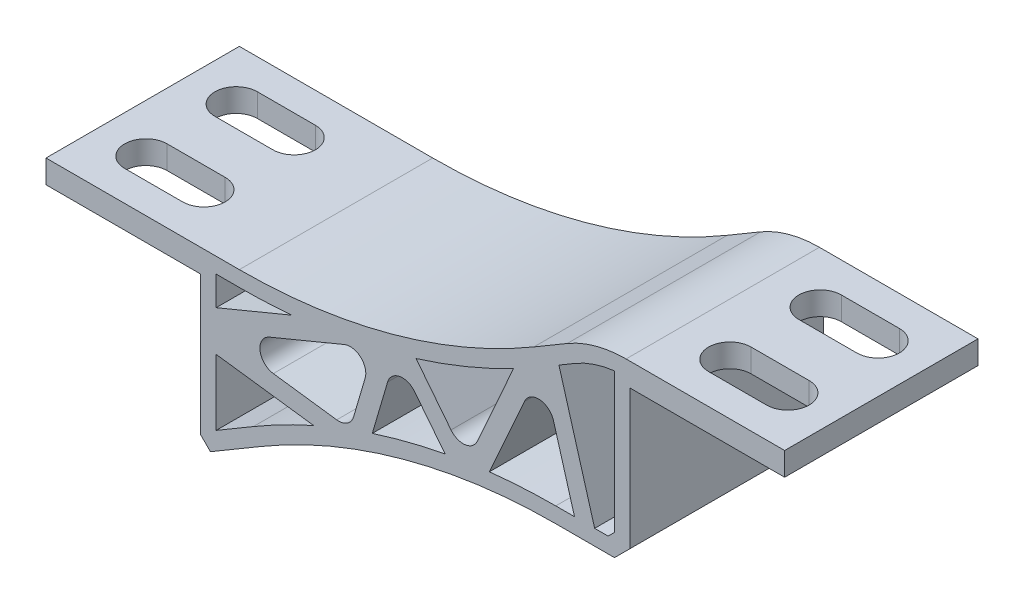
from build123d import *

# Parameters (mm, degrees)
BOSS_EXTRUDE1_DEPTH     = 25
CUT_EXTRUDE2_DEPTH      = 102.361975119
CUT_EXTRUDE2_DEPTH_BACK = 102.361975119
FILLET2_R               = 75
FILLET3_R               = 15
CHAMFER2_SIZE           = 2
CHAMFER3_SIZE           = 2
CHAMFER3_SIZE2          = 1.460674157
CUT_EXTRUDE3_DEPTH      = 101.57900879
CUT_EXTRUDE3_DEPTH_BACK = 101.57900879
FILLET4_R               = 2


with BuildPart() as part:
    # Sketch1 → Boss-Extrude1 (new body)
    with BuildSketch(Plane.XY):
        Polygon((0, 0), (0, 3), (45.454545455, 3), (70.909090909, 18), (95.5, 18), (95.5, 15), (75.5, 15), (75.5, -5), (45.454545455, -5), (20, -20), (20, 0), align=None)
    extrude(amount=BOSS_EXTRUDE1_DEPTH)

    # Sketch3 → Cut-Extrude2 (cut, two sides: drawn at the far end of the back side and taken through both)
    with BuildSketch(Plane(origin=(0, 3, 0), x_dir=(1, 0, 0), z_dir=(0, 1, 0)).offset(-CUT_EXTRUDE2_DEPTH_BACK)):
        with BuildLine():
            Line((6.25, -3.916666667), (13.75, -3.916666667))
            ThreePointArc((13.75, -3.916666667), (16.5, -6.666666667), (13.75, -9.416666667))
            Line((13.75, -9.416666667), (6.25, -9.416666667))
            ThreePointArc((6.25, -9.416666667), (3.5, -6.666666667), (6.25, -3.916666667))
        make_face()
        with BuildLine():
            Line((6.25, -15.583333333), (13.75, -15.583333333))
            ThreePointArc((13.75, -15.583333333), (16.5, -18.333333333), (13.75, -21.083333333))
            Line((13.75, -21.083333333), (6.25, -21.083333333))
            ThreePointArc((6.25, -21.083333333), (3.5, -18.333333333), (6.25, -15.583333333))
        make_face()
        with BuildLine():
            Line((81.75, -3.916666667), (89.25, -3.916666667))
            ThreePointArc((89.25, -3.916666667), (92, -6.666666667), (89.25, -9.416666667))
            Line((89.25, -9.416666667), (81.75, -9.416666667))
            ThreePointArc((81.75, -9.416666667), (79, -6.666666667), (81.75, -3.916666667))
        make_face()
        with BuildLine():
            Line((81.75, -15.583333333), (89.25, -15.583333333))
            ThreePointArc((89.25, -15.583333333), (92, -18.333333333), (89.25, -21.083333333))
            Line((89.25, -21.083333333), (81.75, -21.083333333))
            ThreePointArc((81.75, -21.083333333), (79, -18.333333333), (81.75, -15.583333333))
        make_face()
    extrude(amount=CUT_EXTRUDE2_DEPTH + CUT_EXTRUDE2_DEPTH_BACK, mode=Mode.SUBTRACT)

    # Fillet2
    fillet2_edges = [part.edges().sort_by_distance(p)[0] for p in [
        (45.454545455, -5, 12.5),
        (45.454545455, 3, 12.5),
    ]]
    fillet(fillet2_edges, radius=FILLET2_R)

    # Fillet3
    fillet3_edges = [part.edges().sort_by_distance(p)[0] for p in [
        (70.909090909, 18, 12.5),
    ]]
    fillet(fillet3_edges, radius=FILLET3_R)

    # Chamfer2
    chamfer2_edges = [part.edges().sort_by_distance(p)[0] for p in [
        (75.5, -5, 12.5),
    ]]
    chamfer(chamfer2_edges, length=CHAMFER2_SIZE)

    # Chamfer3
    chamfer3_edges = [part.edges().sort_by_distance(p)[0] for p in [
        (20, -20, 12.5),
    ]]
    chamfer3_side = [part.faces().sort_by_distance(p)[0] for p in [
        (20, -10, 12.5),
    ]]
    chamfer(chamfer3_edges, length=CHAMFER3_SIZE, length2=CHAMFER3_SIZE2, reference=chamfer3_side[0])

    # Sketch4 → Cut-Extrude3 (cut, two sides: drawn at the far end of the back side and taken through both)
    with BuildSketch(Plane.XY.offset(25).offset(-CUT_EXTRUDE3_DEPTH_BACK)):
        with BuildLine():
            Line((22, -2.760448796), (31.806154392, 1.301393348))
            ThreePointArc((31.806154392, 1.301393348), (28.406412173, 1.075385239), (25, 1))
            Line((25, 1), (22, 1))
            Line((22, 1), (22, -2.760448796))
        make_face()
        Polygon((42.445109464, 3.002212327), (39.283210642, -7.75), (22, -5.466429297), align=None)
        with BuildLine():
            ThreePointArc((26.816783217, -13.661538462), (30.651168911, -11.546519911), (34.599587235, -9.652896437))
            Line((34.599587235, -9.652896437), (22, -7.988156657))
            Line((22, -7.988156657), (22, -16.5))
            Line((22, -16.5), (26.816783217, -13.661538462))
        make_face()
        with BuildLine():
            ThreePointArc((42.184281307, -6.746103112), (46.856714422, -5.394323606), (51.605173683, -4.340248798))
            Line((51.605173683, -4.340248798), (45.260040246, 3.713185765))
            Line((45.260040246, 3.713185765), (42.184281307, -6.746103112))
        make_face()
        with BuildLine():
            Line((54.412012222, -3.863168035), (60.453180003, 9.647443152))
            ThreePointArc((60.453180003, 9.647443152), (54.265454394, 6.778281549), (47.848106587, 4.467938793))
            Line((47.848106587, 4.467938793), (54.412012222, -3.863168035))
        make_face()
        with BuildLine():
            Line((68.333642683, -3), (64.092307692, 11.661538462))
            Line((64.092307692, 11.661538462), (57.321727635, -3.480347675))
            ThreePointArc((57.321727635, -3.480347675), (61.608697267, -3.120180707), (65.909090909, -3))
            Line((65.909090909, -3), (68.333642683, -3))
        make_face()
        with BuildLine():
            Line((68.4, 14.2), (66.315776542, 12.971796891))
            Line((66.315776542, 12.971796891), (70.936147126, -3))
            Line((70.936147126, -3), (72.671572875, -3))
            Line((72.671572875, -3), (73.5, -2.171572875))
            Line((73.5, -2.171572875), (73.5, 15.91317157))
            ThreePointArc((73.5, 15.91317157), (70.860405913, 15.323301538), (68.4, 14.2))
        make_face()
    extrude(amount=CUT_EXTRUDE3_DEPTH + CUT_EXTRUDE3_DEPTH_BACK, mode=Mode.SUBTRACT)

    # Fillet4
    fillet4_edges = [part.edges().sort_by_distance(p)[0] for p in [
        (45.260040246, 3.713185765, 12.5),
        (54.412012222, -3.863168035, 12.5),
        (42.445109464, 3.002212327, 12.5),
        (39.283210642, -7.75, 12.5),
        (22, -5.466429297, 12.5),
        (64.092307692, 11.661538462, 12.5),
    ]]
    fillet(fillet4_edges, radius=FILLET4_R)


solid = part.part
